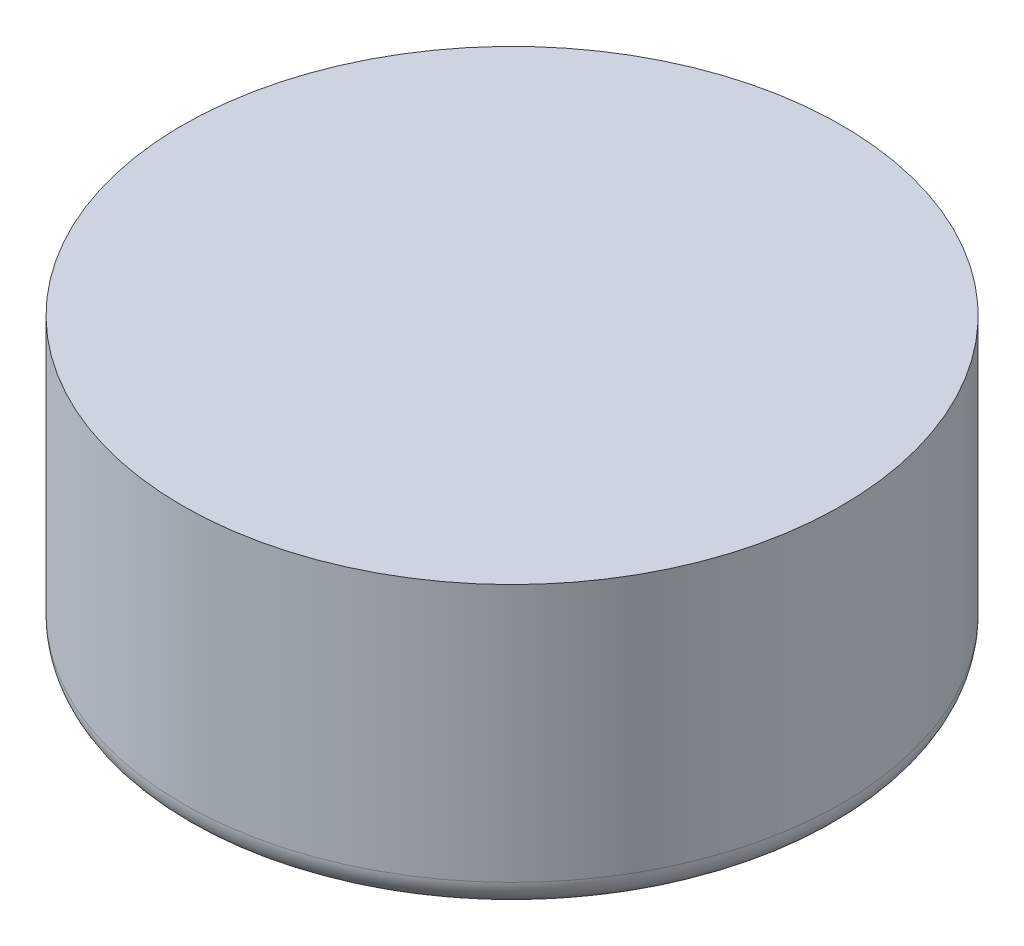
from build123d import *

# Parameters (mm, degrees)
SKETCH1_R           = 14.605
BOSS_EXTRUDE1_DEPTH = 12.7
FILLET1_R           = 1.27


with BuildPart() as part:
    # Sketch1 → Boss-Extrude1 (new body)
    with BuildSketch(Plane(origin=(0, 0, 0), x_dir=(1, 0, 0), z_dir=(0, 1, 0))):
        with Locations(Location((0, 0, 0), (0, 0, 270))):
            Circle(SKETCH1_R)
    extrude(amount=BOSS_EXTRUDE1_DEPTH)

    # Fillet1
    fillet1_edges = [part.edges().sort_by_distance(p)[0] for p in [
        (0, 0, -14.605),
    ]]
    fillet(fillet1_edges, radius=FILLET1_R)


solid = part.part
